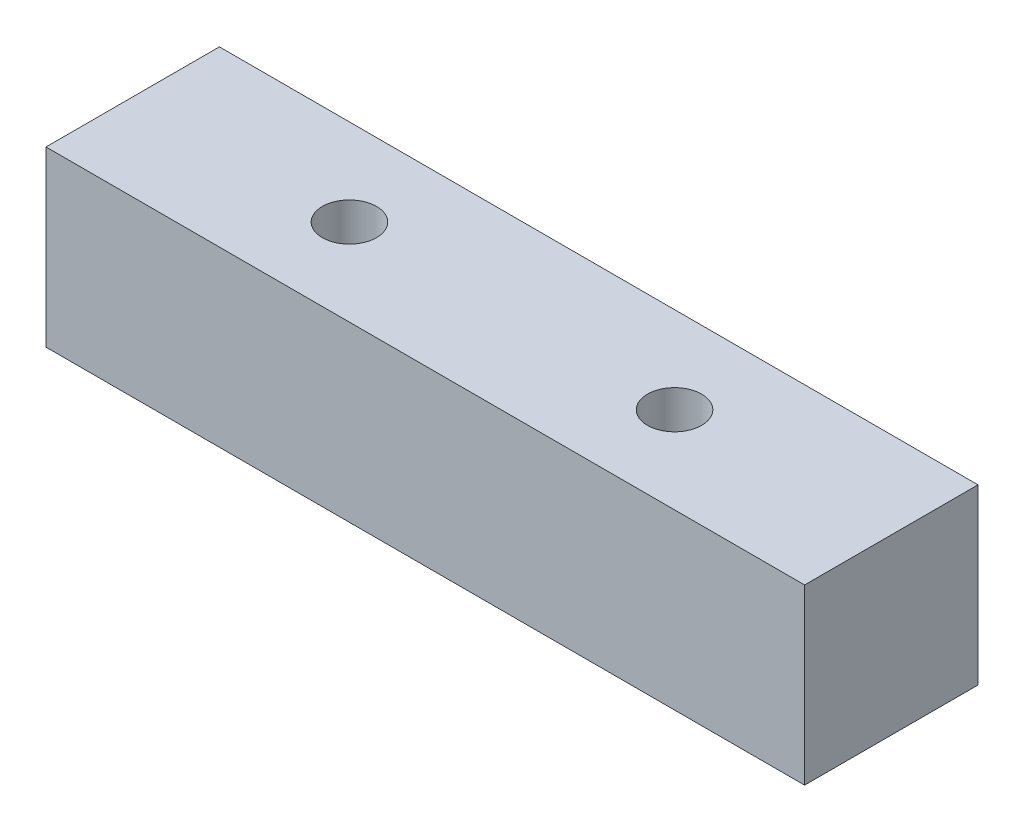
from build123d import *

# Parameters (mm, degrees)
SKETCH1_W           = 88.9
SKETCH1_H           = 20.32
SKETCH1_R           = 3.175
BOSS_EXTRUDE1_DEPTH = 20.32


with BuildPart() as part:
    # Sketch1 → Boss-Extrude1 (new body)
    with BuildSketch(Plane(origin=(0, 0, 0), x_dir=(1, 0, 0), z_dir=(0, 1, 0))):
        Rectangle(SKETCH1_W, SKETCH1_H)
        with Locations(Location((19.05, 0, 0), (0, 0, 270))):
            Circle(SKETCH1_R, mode=Mode.SUBTRACT)
        with Locations(Location((-19.05, 0, 0), (0, 0, 270))):
            Circle(SKETCH1_R, mode=Mode.SUBTRACT)
    extrude(amount=BOSS_EXTRUDE1_DEPTH)


solid = part.part
